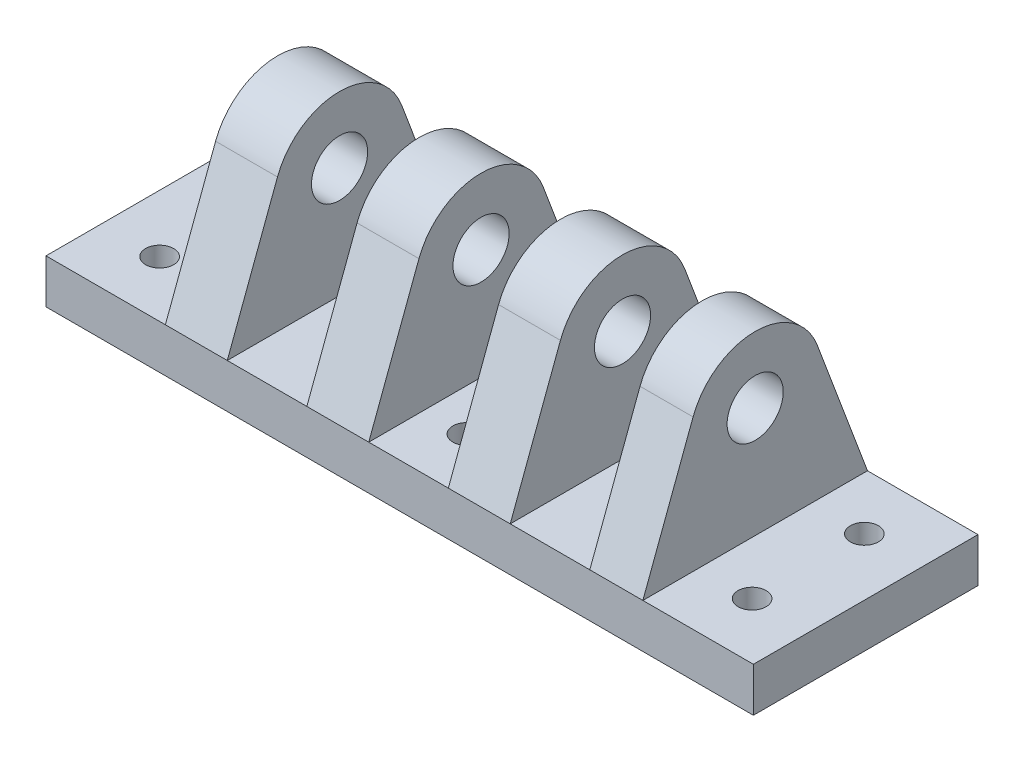
from build123d import *

# Parameters (mm, degrees)
SKETCH1_W                 = 160
SKETCH1_H                 = 50.8
BOSS_EXTRUDE1_DEPTH       = 10
SKETCH2_R                 = 6.35
BOSS_EXTRUDE2_DEPTH       = 160
SKETCH3_W                 = 27
SKETCH3_H                 = 40
SKETCH3_W_2               = 18
SKETCH3_W_3               = 25
CUT_EXTRUDE2_DEPTH        = 176.158899289
F_4_0_25_DIAMETER_HOLE1_D = 6.35


with BuildPart() as part:
    # Sketch1 → Boss-Extrude1 (new body)
    with BuildSketch(Plane(origin=(0, 0, 0), x_dir=(1, 0, 0), z_dir=(0, 1, 0))):
        with Locations((80, 25.4)):
            Rectangle(SKETCH1_W, SKETCH1_H)
    extrude(amount=BOSS_EXTRUDE1_DEPTH)

    # Sketch2 → Boss-Extrude2 (add, through all)
    with BuildSketch(Plane.ZY):
        with BuildLine():
            Line((-50.8, 10), (-39.444175854, 40.268882668))
            ThreePointArc((-39.444175854, 40.268882668), (-25.4, 50), (-11.355824146, 40.268882668))
            Line((-11.355824146, 40.268882668), (0, 10))
            Line((0, 10), (-50.8, 10))
        make_face()
        with Locations((-25.4, 35)):
            Circle(SKETCH2_R, mode=Mode.SUBTRACT)
    extrude(amount=-BOSS_EXTRUDE2_DEPTH)

    # Sketch3 → Cut-Extrude2 (cut, through all)
    with BuildSketch(Plane(origin=(0, 0, -50.8), x_dir=(-1, 0, 0), z_dir=(0, 0, -1))):
        with Locations((-13.5, 30)):
            Rectangle(SKETCH3_W, SKETCH3_H)
        with Locations((-50, 30)):
            Rectangle(SKETCH3_W_2, SKETCH3_H)
        with Locations((-82, 30)):
            Rectangle(SKETCH3_W_2, SKETCH3_H)
        with Locations((-114, 30)):
            Rectangle(SKETCH3_W_2, SKETCH3_H)
        with Locations((-147.5, 30)):
            Rectangle(SKETCH3_W_3, SKETCH3_H)
    extrude(amount=-CUT_EXTRUDE2_DEPTH, mode=Mode.SUBTRACT)

    # #4 (0.25) Diameter Hole1 (through all)
    with Locations(Plane(origin=(0, 10, 0), x_dir=(1, 0, 0), z_dir=(0, 1, 0))):
        with Locations((82.5, 38.1), (82.5, 12.7), (147, 12.7), (147, 38.1), (13, 38.1), (13, 12.7)):
            Hole(F_4_0_25_DIAMETER_HOLE1_D / 2)


solid = part.part
